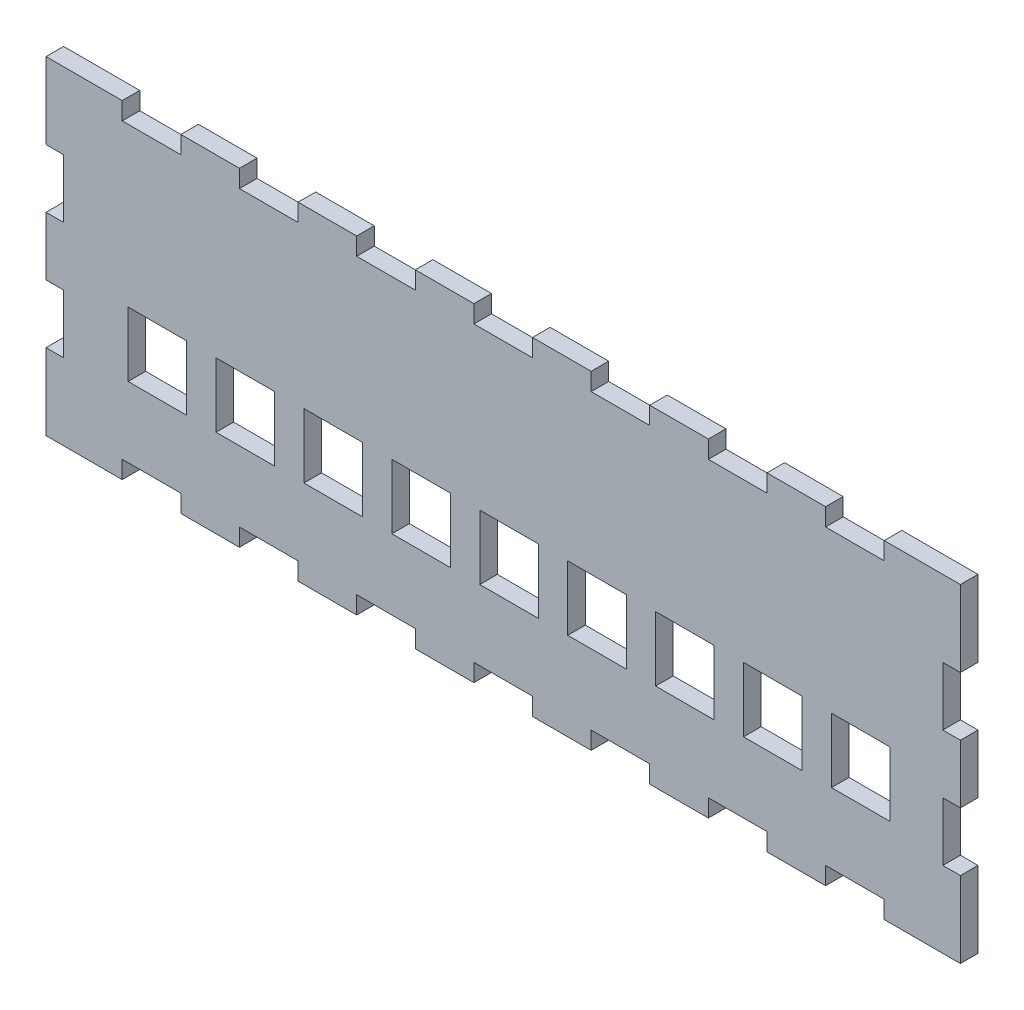
from build123d import *

# Parameters (mm, degrees)
BOSS_EXTRUDE1_DEPTH = 3
SKETCH4_W           = 10
SKETCH4_H           = 11
CUT_EXTRUDE2_DEPTH  = 3


with BuildPart() as part:
    # Sketch1 → Boss-Extrude1 (new body)
    with BuildSketch(Plane.XY):
        Polygon((15, 28), (15, 25), (25, 25), (25, 28), (35, 28), (35, 25), (45, 25), (45, 28), (55, 28), (55, 25), (65, 25), (65, 28), (78, 28), (78, 15), (75, 15), (75, 5), (78, 5), (78, -5), (75, -5), (75, -15), (78, -15), (78, -28), (65, -28), (65, -25), (55, -25), (55, -28), (45, -28), (45, -25), (35, -25), (35, -28), (25, -28), (25, -25), (15, -25), (15, -28), (5, -28), (5, -25), (-5, -25), (-5, -28), (-15, -28), (-15, -25), (-25, -25), (-25, -28), (-35, -28), (-35, -25), (-45, -25), (-45, -28), (-55, -28), (-55, -25), (-65, -25), (-65, -28), (-78, -28), (-78, -15), (-75, -15), (-75, -5), (-78, -5), (-78, 5), (-75, 5), (-75, 15), (-78, 15), (-78, 28), (-65, 28), (-65, 25), (-55, 25), (-55, 28), (-45, 28), (-45, 25), (-35, 25), (-35, 28), (-25, 28), (-25, 25), (-15, 25), (-15, 28), (-5, 28), (-5, 25), (5, 25), (5, 28), align=None)
    extrude(amount=BOSS_EXTRUDE1_DEPTH)

    # Sketch4 → Cut-Extrude2 (cut)
    with BuildSketch(Plane(origin=(0, 0, 0), x_dir=(-1, 0, 0), z_dir=(0, 0, -1))):
        with Locations((-61, -7.5)):
            Rectangle(SKETCH4_W, SKETCH4_H)
        with Locations((-46, -7.5)):
            Rectangle(SKETCH4_W, SKETCH4_H)
        with Locations((-31, -7.5)):
            Rectangle(SKETCH4_W, SKETCH4_H)
        with Locations((-16, -7.5)):
            Rectangle(SKETCH4_W, SKETCH4_H)
        with Locations((-1, -7.5)):
            Rectangle(SKETCH4_W, SKETCH4_H)
        with Locations((14, -7.5)):
            Rectangle(SKETCH4_W, SKETCH4_H)
        with Locations((29, -7.5)):
            Rectangle(SKETCH4_W, SKETCH4_H)
        with Locations((44, -7.5)):
            Rectangle(SKETCH4_W, SKETCH4_H)
        with Locations((59, -7.5)):
            Rectangle(SKETCH4_W, SKETCH4_H)
    extrude(amount=-CUT_EXTRUDE2_DEPTH, mode=Mode.SUBTRACT)


solid = part.part
